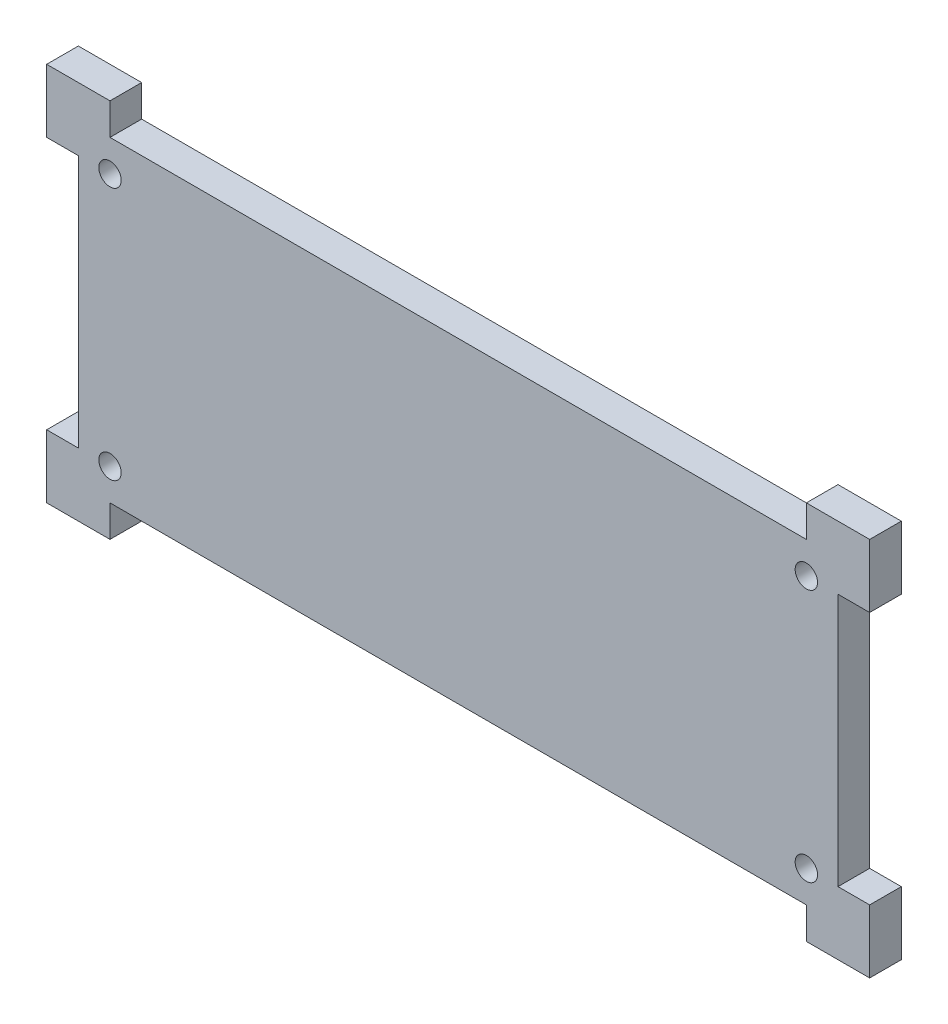
from build123d import *

# Parameters (mm, degrees)
BOSS_EXTRUDE1_DEPTH = 6.35
SKETCH2_R           = 2.2479
CUT_EXTRUDE4_DEPTH  = 129.734406823


with BuildPart() as part:
    # Sketch1 → Boss-Extrude1 (new body)
    with BuildSketch(Plane.XY):
        Polygon((-107.95, -6.35), (-107.95, 6.35), (-101.6, 6.35), (-101.6, 57.15), (-107.95, 57.15), (-107.95, 69.85), (-95.25, 69.85), (-95.25, 63.5), (44.45, 63.5), (44.45, 69.85), (57.15, 69.85), (57.15, 57.15), (50.8, 57.15), (50.8, 6.35), (57.15, 6.35), (57.15, -6.35), (44.45, -6.35), (44.45, 0), (-95.25, 0), (-95.25, -6.35), align=None)
    extrude(amount=BOSS_EXTRUDE1_DEPTH)

    # Sketch2 → Cut-Extrude4 (cut, through all)
    with BuildSketch(Plane.XY.offset(6.35)):
        with Locations((44.45, 6.35)):
            Circle(SKETCH2_R)
        with Locations((44.45, 57.15)):
            Circle(SKETCH2_R)
        with Locations((-95.25, 57.15)):
            Circle(SKETCH2_R)
        with Locations((-95.25, 6.35)):
            Circle(SKETCH2_R)
    extrude(amount=-CUT_EXTRUDE4_DEPTH, mode=Mode.SUBTRACT)


solid = part.part
